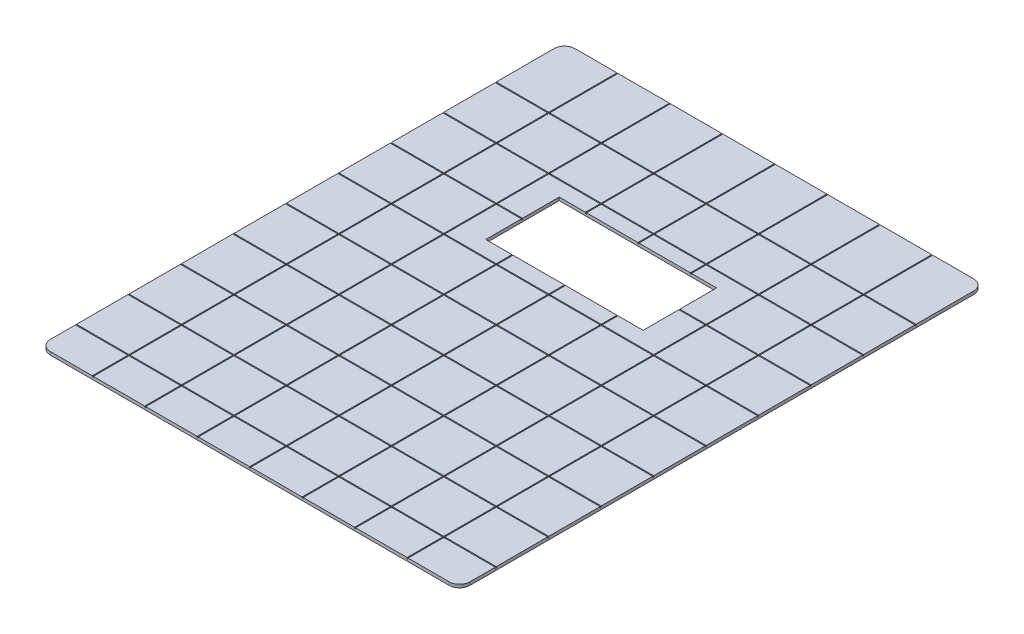
from build123d import *

# Parameters (mm, degrees)
SKETCH1_W               = 400
SKETCH1_H               = 500
BOSS_EXTRUDE1_DEPTH     = 3
FILLET1_R               = 10
SKETCH3_W               = 150
SKETCH3_H               = 70
SKETCH3_W_2             = 130
SKETCH3_H_2             = 50
CUT_EXTRUDE1_DEPTH      = 10
SKETCH5_W               = 400
SKETCH5_H               = 1
CUT_EXTRUDE_THIN1_DEPTH = 1
SKETCH6_W               = 1
SKETCH6_H               = 500
CUT_EXTRUDE_THIN2_DEPTH = 1


with BuildPart() as part:
    # Sketch1 → Boss-Extrude1 (new body)
    with BuildSketch(Plane(origin=(0, 0, 0), x_dir=(1, 0, 0), z_dir=(0, 1, 0))):
        with Locations((200, 250)):
            Rectangle(SKETCH1_W, SKETCH1_H)
    extrude(amount=BOSS_EXTRUDE1_DEPTH)

    # Fillet1
    fillet1_edges = [part.edges().sort_by_distance(p)[0] for p in [
        (0, 1.5, -500),
        (400, 1.5, -500),
        (400, 1.5, 0),
        (0, 1.5, 0),
    ]]
    fillet(fillet1_edges, radius=FILLET1_R)

    # Sketch3 → Cut-Extrude1 (cut)
    # profile 1 of 2: a face of its own
    with BuildSketch(Plane(origin=(0, 3, 0), x_dir=(1, 0, 0), z_dir=(0, 1, 0))):
        with Locations((200, 335)):
            Rectangle(SKETCH3_W, SKETCH3_H)
        with Locations((200, 335)):
            Rectangle(SKETCH3_W_2, SKETCH3_H_2, mode=Mode.SUBTRACT)
    # profile 2 of 2: a face of its own
    with BuildSketch(Plane(origin=(0, 3, 0), x_dir=(1, 0, 0), z_dir=(0, 1, 0))):
        with Locations((200, 335)):
            Rectangle(SKETCH3_W_2, SKETCH3_H_2)
    extrude(amount=-CUT_EXTRUDE1_DEPTH, mode=Mode.SUBTRACT)

    # Sketch5 → Cut-Extrude-Thin1 (cut)
    with BuildSketch(Plane(origin=(0, 3, 0), x_dir=(1, 0, 0), z_dir=(0, 1, 0))):
        with Locations((200, 234.5)):
            Rectangle(SKETCH5_W, SKETCH5_H)
        with Locations((200, 184.5)):
            Rectangle(SKETCH5_W, SKETCH5_H)
        with Locations((200, 84.5)):
            Rectangle(SKETCH5_W, SKETCH5_H)
        with Locations((200, 134.5)):
            Rectangle(SKETCH5_W, SKETCH5_H)
        with Locations((200, 284.5)):
            Rectangle(SKETCH5_W, SKETCH5_H)
        with Locations((200, 334.5)):
            Rectangle(SKETCH5_W, SKETCH5_H)
        with Locations((200, 384.5)):
            Rectangle(SKETCH5_W, SKETCH5_H)
        with Locations((200, 434.5)):
            Rectangle(SKETCH5_W, SKETCH5_H)
        with Locations((200, 34.5)):
            Rectangle(SKETCH5_W, SKETCH5_H)
    extrude(amount=-CUT_EXTRUDE_THIN1_DEPTH, mode=Mode.SUBTRACT)

    # Sketch6 → Cut-Extrude-Thin2 (cut)
    with BuildSketch(Plane(origin=(0, 3, 0), x_dir=(1, 0, 0), z_dir=(0, 1, 0))):
        with Locations((200.5, 250)):
            Rectangle(SKETCH6_W, SKETCH6_H)
        with Locations((250.5, 250)):
            Rectangle(SKETCH6_W, SKETCH6_H)
        with Locations((300.5, 250)):
            Rectangle(SKETCH6_W, SKETCH6_H)
        with Locations((350.5, 250)):
            Rectangle(SKETCH6_W, SKETCH6_H)
        with Locations((50.5, 250)):
            Rectangle(SKETCH6_W, SKETCH6_H)
        with Locations((100.5, 250)):
            Rectangle(SKETCH6_W, SKETCH6_H)
        with Locations((150.5, 250)):
            Rectangle(SKETCH6_W, SKETCH6_H)
    extrude(amount=-CUT_EXTRUDE_THIN2_DEPTH, mode=Mode.SUBTRACT)


solid = part.part
